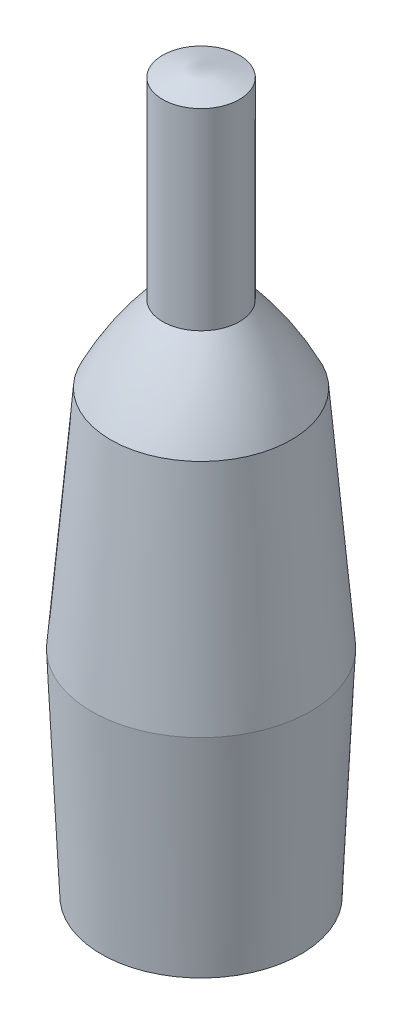
from build123d import *


with BuildPart() as part:
    # Sketch1 → Revolve1 (revolve)
    with BuildSketch(Plane(origin=(0, 0, 0), x_dir=(0, 0, -1), z_dir=(1, 0, 0)), mode=Mode.PRIVATE) as revolve1_sk:
        with BuildLine():
            Line((0, 285), (-15.183832064, 280.713521285))
            Line((-15.183832064, 280.713521285), (-15.183832064, 204.573878901))
            ThreePointArc((-15.183832064, 204.573878901), (-26.52497456, 190.178602644), (-35.724089927, 174.328625732))
            Line((-35.724089927, 174.328625732), (-43.273108401, 85.043654791))
            Line((-43.273108401, 85.043654791), (-39.498599164, 0))
            Line((-39.498599164, 0), (0, 0))
            Line((0, 0), (0, 285))
        make_face()
    revolve(revolve1_sk.sketch.rotate(Axis((0, 0, 0), (0, 1, 0)), 180), axis=Axis((0, 0, 0), (0, 1, 0)))


solid = part.part
